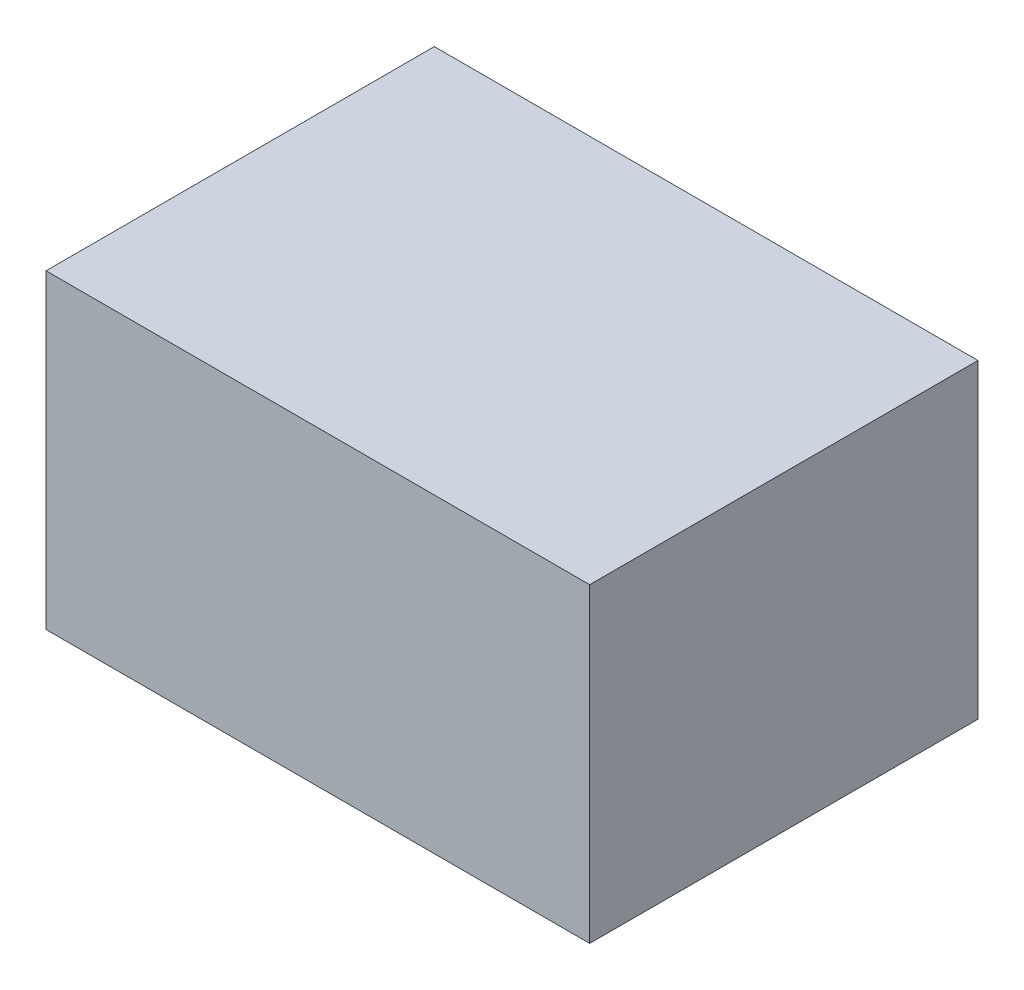
from build123d import *

# Parameters (mm, degrees)
SKETCH1_W           = 140
SKETCH1_H           = 100
BOSS_EXTRUDE1_DEPTH = 80


with BuildPart() as part:
    # Sketch1 → Boss-Extrude1 (new body)
    with BuildSketch(Plane(origin=(0, 0, 0), x_dir=(1, 0, 0), z_dir=(0, 1, 0))):
        with Locations((70, 50)):
            Rectangle(SKETCH1_W, SKETCH1_H)
    extrude(amount=BOSS_EXTRUDE1_DEPTH)


solid = part.part
